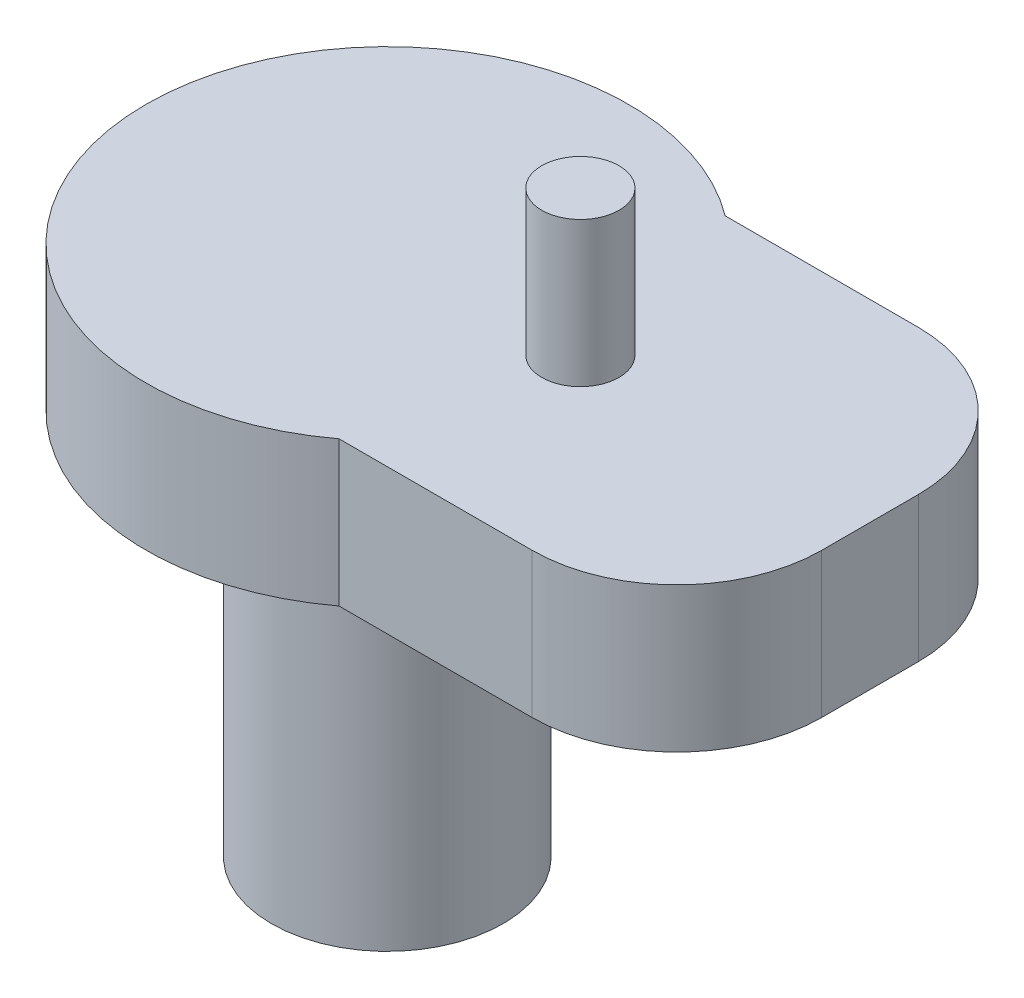
from build123d import *

# Parameters (mm, degrees)
SKETCH1_R                = 25
BOSS_EXTRUDE1_DEPTH      = 15
SKETCH1_3_R              = 12
BOSS_EXTRUDE2_DEPTH      = 40
BOSS_EXTRUDE4_REACH      = 105.385
BOSS_EXTRUDE4_END_RADIUS = 25
BOSS_EXTRUDE4_START      = 50
SKETCH4_W                = 40
SKETCH4_H                = 15
FILLET2_R                = 15
BOSS_EXTRUDE8_START      = 15
SKETCH7_R                = 4
BOSS_EXTRUDE8_DEPTH      = 15


with BuildPart() as part:
    # Sketch1 → Boss-Extrude1 (new body)
    with BuildSketch(Plane(origin=(0, 0, 0), x_dir=(1, 0, 0), z_dir=(0, 1, 0))):
        with Locations(Location((0, 0, 0), (0, 0, 270))):
            Circle(SKETCH1_R)
    extrude(amount=BOSS_EXTRUDE1_DEPTH)

    # Sketch1<3> → Boss-Extrude2 (add)
    with BuildSketch(Plane(origin=(0, 0, 0), x_dir=(1, 0, 0), z_dir=(0, 1, 0))):
        with Locations(Location((0, 0, 0), (0, 0, 270))):
            Circle(SKETCH1_3_R)
    extrude(amount=-BOSS_EXTRUDE2_DEPTH)

    # Boss-Extrude4: up to this cylinder (the profile starts outside it)
    boss_extrude4_end = Plane(origin=(0, 7.5, 0), z_dir=(0, -1, 0)) * Cylinder(BOSS_EXTRUDE4_END_RADIUS, 261.77, mode=Mode.PRIVATE)
    # Sketch4 → Boss-Extrude4 (add, up to the surface)
    with BuildSketch(Plane(origin=(0, 0, 0), x_dir=(0, 0, -1), z_dir=(1, 0, 0)).offset(BOSS_EXTRUDE4_START), mode=Mode.PRIVATE) as boss_extrude4_sk1:
        with Locations((0, 7.5)):
            Rectangle(SKETCH4_W, SKETCH4_H)
    boss_extrude4_tool1 = extrude(boss_extrude4_sk1.sketch, amount=-BOSS_EXTRUDE4_REACH, mode=Mode.PRIVATE) - boss_extrude4_end
    add(boss_extrude4_tool1.solids().sort_by_distance((50, 7.5, 0))[0])

    # Fillet2
    fillet2_edges = [part.edges().sort_by_distance(p)[0] for p in [
        (50, 7.5, -20),
        (50, 7.5, 20),
    ]]
    fillet(fillet2_edges, radius=FILLET2_R)

    # Sketch7 → Boss-Extrude8 (add)
    with BuildSketch(Plane(origin=(0, 0, 0), x_dir=(1, 0, 0), z_dir=(0, 1, 0)).offset(BOSS_EXTRUDE8_START)):
        with Locations(Location((20, 0, 0), (0, 0, 270))):
            Circle(SKETCH7_R)
    extrude(amount=BOSS_EXTRUDE8_DEPTH)


solid = part.part
